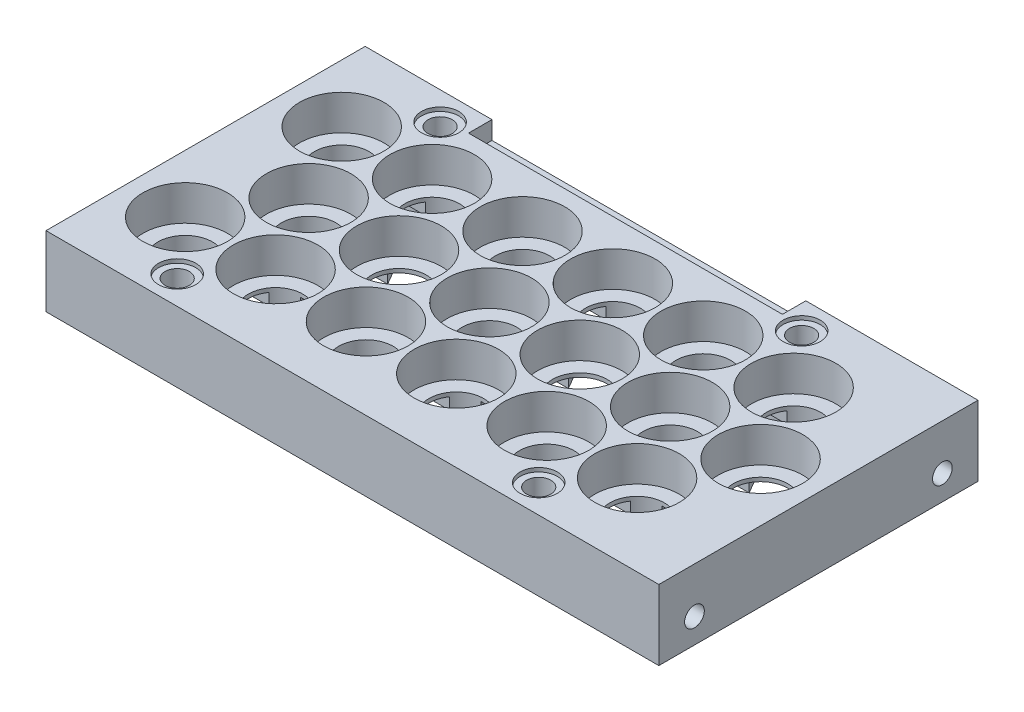
from build123d import *

# Parameters (mm, degrees)
BOSS_EXTRUDE2_DEPTH      = 11
BOSS_EXTRUDE2_DEPTH_BACK = 2
SKETCH1_W                = 156.975
SKETCH1_H                = 81.746976195
SKETCH1_R                = 10.825
BOSS_EXTRUDE3_DEPTH      = 2
BOSS_EXTRUDE3_DEPTH_BACK = 2
SKETCH1_3_R              = 10.825
SKETCH1_3_R_2            = 7
CUT_EXTRUDE1_DEPTH       = 3
CUT_EXTRUDE3_REACH       = 157.2
SKETCH9_R                = 3.1
SKETCH10_R               = 4.7625
CUT_EXTRUDE4_DEPTH       = 1
SKETCH13_W               = 156.975
SKETCH13_H               = 81.746976195
SKETCH13_R               = 3.1
BOSS_EXTRUDE7_DEPTH      = 5
SKETCH18_W               = 80.4
SKETCH18_H               = 4.825
CUT_EXTRUDE6_DEPTH       = 6
SKETCH19_R               = 2.525
CUT_EXTRUDE7_DEPTH       = 5
SKETCH20_R               = 2.525
CUT_EXTRUDE8_DEPTH       = 10
SKETCH21_R               = 1.9431
CUT_EXTRUDE9_DEPTH       = 3.81


with BuildPart() as part:
    # Sketch1 → Boss-Extrude2 (new, two sides: drawn at the far end of the back side and taken through both)
    with BuildSketch(Plane(origin=(0, 0, 0), x_dir=(1, 0, 0), z_dir=(0, 1, 0)).offset(-BOSS_EXTRUDE2_DEPTH_BACK)):
        with Locations((63.6625, -20.048488098)):
            Rectangle(SKETCH1_W, SKETCH1_H)
        with Locations(Location((115.75, -40.096976195, 0), (0, 0, 270))):
            Circle(SKETCH1_R, mode=Mode.SUBTRACT)
        with Locations(Location((127.325, -20.048488098, 0), (0, 0, 270))):
            Circle(SKETCH1_R, mode=Mode.SUBTRACT)
        with Locations(Location((115.75, 0, 0), (0, 0, 270))):
            Circle(SKETCH1_R, mode=Mode.SUBTRACT)
        with Locations(Location((92.6, -40.096976195, 0), (0, 0, 270))):
            Circle(SKETCH1_R, mode=Mode.SUBTRACT)
        with Locations(Location((104.175, -20.048488098, 0), (0, 0, 270))):
            Circle(SKETCH1_R, mode=Mode.SUBTRACT)
        with Locations(Location((92.6, 0, 0), (0, 0, 270))):
            Circle(SKETCH1_R, mode=Mode.SUBTRACT)
        with Locations(Location((69.45, -40.096976195, 0), (0, 0, 270))):
            Circle(SKETCH1_R, mode=Mode.SUBTRACT)
        with Locations(Location((81.025, -20.048488098, 0), (0, 0, 270))):
            Circle(SKETCH1_R, mode=Mode.SUBTRACT)
        with Locations(Location((69.45, 0, 0), (0, 0, 270))):
            Circle(SKETCH1_R, mode=Mode.SUBTRACT)
        with Locations(Location((46.3, -40.096976195, 0), (0, 0, 270))):
            Circle(SKETCH1_R, mode=Mode.SUBTRACT)
        with Locations(Location((57.875, -20.048488098, 0), (0, 0, 270))):
            Circle(SKETCH1_R, mode=Mode.SUBTRACT)
        with Locations(Location((46.3, 0, 0), (0, 0, 270))):
            Circle(SKETCH1_R, mode=Mode.SUBTRACT)
        with Locations(Location((23.15, -40.096976195, 0), (0, 0, 270))):
            Circle(SKETCH1_R, mode=Mode.SUBTRACT)
        with Locations(Location((34.725, -20.048488098, 0), (0, 0, 270))):
            Circle(SKETCH1_R, mode=Mode.SUBTRACT)
        with Locations(Location((23.15, 0, 0), (0, 0, 270))):
            Circle(SKETCH1_R, mode=Mode.SUBTRACT)
        with Locations(Location((0, -40.096976195, 0), (0, 0, 270))):
            Circle(SKETCH1_R, mode=Mode.SUBTRACT)
        with Locations(Location((11.575, -20.048488098, 0), (0, 0, 270))):
            Circle(SKETCH1_R, mode=Mode.SUBTRACT)
        with Locations(Location((0, 0, 0), (0, 0, 270))):
            Circle(SKETCH1_R, mode=Mode.SUBTRACT)
    extrude(amount=BOSS_EXTRUDE2_DEPTH + BOSS_EXTRUDE2_DEPTH_BACK)

    # Sketch1<3> → Boss-Extrude3 (add, two sides: drawn at the far end of the back side and taken through both)
    # profile 1 of 18: a face of its own
    with BuildSketch(Plane(origin=(0, 0, 0), x_dir=(1, 0, 0), z_dir=(0, 1, 0)).offset(-BOSS_EXTRUDE3_DEPTH_BACK)):
        with Locations(Location((0, 0, 0), (0, 0, 270))):
            Circle(SKETCH1_3_R)
        with Locations(Location((0, 0, 0), (0, 0, 270))):
            Circle(SKETCH1_3_R_2, mode=Mode.SUBTRACT)
    # profile 2 of 18: a face of its own
    with BuildSketch(Plane(origin=(0, 0, 0), x_dir=(1, 0, 0), z_dir=(0, 1, 0)).offset(-BOSS_EXTRUDE3_DEPTH_BACK)):
        with Locations(Location((23.15, 0, 0), (0, 0, 270))):
            Circle(SKETCH1_3_R)
        with Locations(Location((23.15, 0, 0), (0, 0, 270))):
            Circle(SKETCH1_3_R_2, mode=Mode.SUBTRACT)
    # profile 3 of 18: a face of its own
    with BuildSketch(Plane(origin=(0, 0, 0), x_dir=(1, 0, 0), z_dir=(0, 1, 0)).offset(-BOSS_EXTRUDE3_DEPTH_BACK)):
        with Locations(Location((46.3, 0, 0), (0, 0, 270))):
            Circle(SKETCH1_3_R)
        with Locations(Location((46.3, 0, 0), (0, 0, 270))):
            Circle(SKETCH1_3_R_2, mode=Mode.SUBTRACT)
    # profile 4 of 18: a face of its own
    with BuildSketch(Plane(origin=(0, 0, 0), x_dir=(1, 0, 0), z_dir=(0, 1, 0)).offset(-BOSS_EXTRUDE3_DEPTH_BACK)):
        with Locations(Location((69.45, 0, 0), (0, 0, 270))):
            Circle(SKETCH1_3_R)
        with Locations(Location((69.45, 0, 0), (0, 0, 270))):
            Circle(SKETCH1_3_R_2, mode=Mode.SUBTRACT)
    # profile 5 of 18: a face of its own
    with BuildSketch(Plane(origin=(0, 0, 0), x_dir=(1, 0, 0), z_dir=(0, 1, 0)).offset(-BOSS_EXTRUDE3_DEPTH_BACK)):
        with Locations(Location((92.6, 0, 0), (0, 0, 270))):
            Circle(SKETCH1_3_R)
        with Locations(Location((92.6, 0, 0), (0, 0, 270))):
            Circle(SKETCH1_3_R_2, mode=Mode.SUBTRACT)
    # profile 6 of 18: a face of its own
    with BuildSketch(Plane(origin=(0, 0, 0), x_dir=(1, 0, 0), z_dir=(0, 1, 0)).offset(-BOSS_EXTRUDE3_DEPTH_BACK)):
        with Locations(Location((115.75, 0, 0), (0, 0, 270))):
            Circle(SKETCH1_3_R)
        with Locations(Location((115.75, 0, 0), (0, 0, 270))):
            Circle(SKETCH1_3_R_2, mode=Mode.SUBTRACT)
    # profile 7 of 18: a face of its own
    with BuildSketch(Plane(origin=(0, 0, 0), x_dir=(1, 0, 0), z_dir=(0, 1, 0)).offset(-BOSS_EXTRUDE3_DEPTH_BACK)):
        with Locations(Location((11.575, -20.048488098, 0), (0, 0, 270))):
            Circle(SKETCH1_3_R)
        with Locations(Location((11.575, -20.048488098, 0), (0, 0, 270))):
            Circle(SKETCH1_3_R_2, mode=Mode.SUBTRACT)
    # profile 8 of 18: a face of its own
    with BuildSketch(Plane(origin=(0, 0, 0), x_dir=(1, 0, 0), z_dir=(0, 1, 0)).offset(-BOSS_EXTRUDE3_DEPTH_BACK)):
        with Locations(Location((34.725, -20.048488098, 0), (0, 0, 270))):
            Circle(SKETCH1_3_R)
        with Locations(Location((34.725, -20.048488098, 0), (0, 0, 270))):
            Circle(SKETCH1_3_R_2, mode=Mode.SUBTRACT)
    # profile 9 of 18: a face of its own
    with BuildSketch(Plane(origin=(0, 0, 0), x_dir=(1, 0, 0), z_dir=(0, 1, 0)).offset(-BOSS_EXTRUDE3_DEPTH_BACK)):
        with Locations(Location((57.875, -20.048488098, 0), (0, 0, 270))):
            Circle(SKETCH1_3_R)
        with Locations(Location((57.875, -20.048488098, 0), (0, 0, 270))):
            Circle(SKETCH1_3_R_2, mode=Mode.SUBTRACT)
    # profile 10 of 18: a face of its own
    with BuildSketch(Plane(origin=(0, 0, 0), x_dir=(1, 0, 0), z_dir=(0, 1, 0)).offset(-BOSS_EXTRUDE3_DEPTH_BACK)):
        with Locations(Location((81.025, -20.048488098, 0), (0, 0, 270))):
            Circle(SKETCH1_3_R)
        with Locations(Location((81.025, -20.048488098, 0), (0, 0, 270))):
            Circle(SKETCH1_3_R_2, mode=Mode.SUBTRACT)
    # profile 11 of 18: a face of its own
    with BuildSketch(Plane(origin=(0, 0, 0), x_dir=(1, 0, 0), z_dir=(0, 1, 0)).offset(-BOSS_EXTRUDE3_DEPTH_BACK)):
        with Locations(Location((104.175, -20.048488098, 0), (0, 0, 270))):
            Circle(SKETCH1_3_R)
        with Locations(Location((104.175, -20.048488098, 0), (0, 0, 270))):
            Circle(SKETCH1_3_R_2, mode=Mode.SUBTRACT)
    # profile 12 of 18: a face of its own
    with BuildSketch(Plane(origin=(0, 0, 0), x_dir=(1, 0, 0), z_dir=(0, 1, 0)).offset(-BOSS_EXTRUDE3_DEPTH_BACK)):
        with Locations(Location((127.325, -20.048488098, 0), (0, 0, 270))):
            Circle(SKETCH1_3_R)
        with Locations(Location((127.325, -20.048488098, 0), (0, 0, 270))):
            Circle(SKETCH1_3_R_2, mode=Mode.SUBTRACT)
    # profile 13 of 18: a face of its own
    with BuildSketch(Plane(origin=(0, 0, 0), x_dir=(1, 0, 0), z_dir=(0, 1, 0)).offset(-BOSS_EXTRUDE3_DEPTH_BACK)):
        with Locations(Location((115.75, -40.096976195, 0), (0, 0, 270))):
            Circle(SKETCH1_3_R)
        with Locations(Location((115.75, -40.096976195, 0), (0, 0, 270))):
            Circle(SKETCH1_3_R_2, mode=Mode.SUBTRACT)
    # profile 14 of 18: a face of its own
    with BuildSketch(Plane(origin=(0, 0, 0), x_dir=(1, 0, 0), z_dir=(0, 1, 0)).offset(-BOSS_EXTRUDE3_DEPTH_BACK)):
        with Locations(Location((92.6, -40.096976195, 0), (0, 0, 270))):
            Circle(SKETCH1_3_R)
        with Locations(Location((92.6, -40.096976195, 0), (0, 0, 270))):
            Circle(SKETCH1_3_R_2, mode=Mode.SUBTRACT)
    # profile 15 of 18: a face of its own
    with BuildSketch(Plane(origin=(0, 0, 0), x_dir=(1, 0, 0), z_dir=(0, 1, 0)).offset(-BOSS_EXTRUDE3_DEPTH_BACK)):
        with Locations(Location((69.45, -40.096976195, 0), (0, 0, 270))):
            Circle(SKETCH1_3_R)
        with Locations(Location((69.45, -40.096976195, 0), (0, 0, 270))):
            Circle(SKETCH1_3_R_2, mode=Mode.SUBTRACT)
    # profile 16 of 18: a face of its own
    with BuildSketch(Plane(origin=(0, 0, 0), x_dir=(1, 0, 0), z_dir=(0, 1, 0)).offset(-BOSS_EXTRUDE3_DEPTH_BACK)):
        with Locations(Location((46.3, -40.096976195, 0), (0, 0, 270))):
            Circle(SKETCH1_3_R)
        with Locations(Location((46.3, -40.096976195, 0), (0, 0, 270))):
            Circle(SKETCH1_3_R_2, mode=Mode.SUBTRACT)
    # profile 17 of 18: a face of its own
    with BuildSketch(Plane(origin=(0, 0, 0), x_dir=(1, 0, 0), z_dir=(0, 1, 0)).offset(-BOSS_EXTRUDE3_DEPTH_BACK)):
        with Locations(Location((23.15, -40.096976195, 0), (0, 0, 270))):
            Circle(SKETCH1_3_R)
        with Locations(Location((23.15, -40.096976195, 0), (0, 0, 270))):
            Circle(SKETCH1_3_R_2, mode=Mode.SUBTRACT)
    # profile 18 of 18: a face of its own
    with BuildSketch(Plane(origin=(0, 0, 0), x_dir=(1, 0, 0), z_dir=(0, 1, 0)).offset(-BOSS_EXTRUDE3_DEPTH_BACK)):
        with Locations(Location((0, -40.096976195, 0), (0, 0, 270))):
            Circle(SKETCH1_3_R)
        with Locations(Location((0, -40.096976195, 0), (0, 0, 270))):
            Circle(SKETCH1_3_R_2, mode=Mode.SUBTRACT)
    extrude(amount=BOSS_EXTRUDE3_DEPTH + BOSS_EXTRUDE3_DEPTH_BACK)

    # Sketch2 → Cut-Extrude1 (cut)
    with BuildSketch(Plane.XZ.offset(2)):
        with BuildLine():
            ThreePointArc((7, 40.096976195), (6.832081695, 38.57294873), (6.336382938, 37.12203901))
            Line((6.336382938, 37.12203901), (6.92820323, 36.096976195))
            Line((6.92820323, 36.096976195), (17.405437353, 36.096976195))
            ThreePointArc((17.405437353, 36.096976195), (16.15, 40.096976195), (17.405437353, 44.096976195))
            Line((17.405437353, 44.096976195), (5.744562647, 44.096976195))
            ThreePointArc((5.744562647, 44.096976195), (6.678770041, 42.193170541), (7, 40.096976195))
        make_face()
        with BuildLine():
            ThreePointArc((28.894562647, 36.096976195), (26.124937186, 33.760593257), (22.558179708, 33.12203901))
            Line((22.558179708, 33.12203901), (27.79679677, 24.048488098))
            Line((27.79679677, 24.048488098), (28.980437353, 24.048488098))
            ThreePointArc((28.980437353, 24.048488098), (31.750062814, 26.384871036), (35.316820292, 27.023425283))
            Line((35.316820292, 27.023425283), (30.07820323, 36.096976195))
            Line((30.07820323, 36.096976195), (28.894562647, 36.096976195))
        make_face()
        with BuildLine():
            Line((27.79679677, 24.048488098), (17.319562647, 24.048488098))
            ThreePointArc((17.319562647, 24.048488098), (18.253770041, 22.144682444), (18.575, 20.048488098))
            ThreePointArc((18.575, 20.048488098), (18.253770041, 17.952293751), (17.319562647, 16.048488098))
            Line((17.319562647, 16.048488098), (27.79679677, 16.048488098))
            Line((27.79679677, 16.048488098), (28.388617062, 17.073550912))
            ThreePointArc((28.388617062, 17.073550912), (27.725, 20.048488098), (28.388617062, 23.023425283))
            Line((28.388617062, 23.023425283), (27.79679677, 24.048488098))
        make_face()
        with BuildLine():
            ThreePointArc((7, 0), (6.678770041, -2.096194346), (5.744562647, -4))
            Line((5.744562647, -4), (17.405437353, -4))
            ThreePointArc((17.405437353, -4), (16.15, 0), (17.405437353, 4))
            Line((17.405437353, 4), (6.92820323, 4))
            Line((6.92820323, 4), (6.336382938, 2.974937186))
            ThreePointArc((6.336382938, 2.974937186), (6.832081695, 1.524027465), (7, 0))
        make_face()
        with BuildLine():
            Line((28.980437353, 16.048488098), (27.79679677, 16.048488098))
            Line((27.79679677, 16.048488098), (22.558179708, 6.974937186))
            ThreePointArc((22.558179708, 6.974937186), (26.124937186, 6.336382938), (28.894562647, 4))
            Line((28.894562647, 4), (30.07820323, 4))
            Line((30.07820323, 4), (35.316820292, 13.073550912))
            ThreePointArc((35.316820292, 13.073550912), (31.750062814, 13.712105159), (28.980437353, 16.048488098))
        make_face()
        with BuildLine():
            ThreePointArc((28.980437353, 16.048488098), (28.662822174, 16.548488098), (28.388617062, 17.073550912))
            Line((28.388617062, 17.073550912), (27.79679677, 16.048488098))
            Line((27.79679677, 16.048488098), (28.980437353, 16.048488098))
        make_face()
        with BuildLine():
            Line((28.980437353, 24.048488098), (27.79679677, 24.048488098))
            Line((27.79679677, 24.048488098), (28.388617062, 23.023425283))
            ThreePointArc((28.388617062, 23.023425283), (28.662822174, 23.548488098), (28.980437353, 24.048488098))
        make_face()
        with BuildLine():
            Line((6.92820323, 36.096976195), (6.336382938, 37.12203901))
            ThreePointArc((6.336382938, 37.12203901), (6.062177826, 36.596976195), (5.744562647, 36.096976195))
            Line((5.744562647, 36.096976195), (6.92820323, 36.096976195))
        make_face()
        with BuildLine():
            Line((6.92820323, 4), (5.744562647, 4))
            ThreePointArc((5.744562647, 4), (6.062177826, 3.5), (6.336382938, 2.974937186))
            Line((6.336382938, 2.974937186), (6.92820323, 4))
        make_face()
        with BuildLine():
            Line((30.07820323, 4), (28.894562647, 4))
            ThreePointArc((28.894562647, 4), (29.212177826, 3.5), (29.486382938, 2.974937186))
            Line((29.486382938, 2.974937186), (30.07820323, 4))
        make_face()
        with BuildLine():
            Line((74.688617062, 23.023425283), (74.09679677, 24.048488098))
            Line((74.09679677, 24.048488098), (63.619562647, 24.048488098))
            ThreePointArc((63.619562647, 24.048488098), (64.553770041, 22.144682444), (64.875, 20.048488098))
            ThreePointArc((64.875, 20.048488098), (64.553770041, 17.952293751), (63.619562647, 16.048488098))
            Line((63.619562647, 16.048488098), (74.09679677, 16.048488098))
            Line((74.09679677, 16.048488098), (74.688617062, 17.073550912))
            ThreePointArc((74.688617062, 17.073550912), (74.025, 20.048488098), (74.688617062, 23.023425283))
        make_face()
        with BuildLine():
            ThreePointArc((53.3, 0), (52.978770041, -2.096194346), (52.044562647, -4))
            Line((52.044562647, -4), (63.705437353, -4))
            ThreePointArc((63.705437353, -4), (62.45, 0), (63.705437353, 4))
            Line((63.705437353, 4), (53.22820323, 4))
            Line((53.22820323, 4), (52.636382938, 2.974937186))
            ThreePointArc((52.636382938, 2.974937186), (53.132081695, 1.524027465), (53.3, 0))
        make_face()
        with BuildLine():
            Line((63.705437353, 44.096976195), (52.044562647, 44.096976195))
            ThreePointArc((52.044562647, 44.096976195), (52.978770041, 42.193170541), (53.3, 40.096976195))
            ThreePointArc((53.3, 40.096976195), (53.132081695, 38.57294873), (52.636382938, 37.12203901))
            Line((52.636382938, 37.12203901), (53.22820323, 36.096976195))
            Line((53.22820323, 36.096976195), (63.705437353, 36.096976195))
            ThreePointArc((63.705437353, 36.096976195), (62.45, 40.096976195), (63.705437353, 44.096976195))
        make_face()
        with BuildLine():
            ThreePointArc((75.194562647, 36.096976195), (72.424937186, 33.760593257), (68.858179708, 33.12203901))
            Line((68.858179708, 33.12203901), (74.09679677, 24.048488098))
            Line((74.09679677, 24.048488098), (75.280437353, 24.048488098))
            ThreePointArc((75.280437353, 24.048488098), (78.050062814, 26.384871036), (81.616820292, 27.023425283))
            Line((81.616820292, 27.023425283), (76.37820323, 36.096976195))
            Line((76.37820323, 36.096976195), (75.194562647, 36.096976195))
        make_face()
        with BuildLine():
            Line((75.280437353, 16.048488098), (74.09679677, 16.048488098))
            Line((74.09679677, 16.048488098), (68.858179708, 6.974937186))
            ThreePointArc((68.858179708, 6.974937186), (72.424937186, 6.336382938), (75.194562647, 4))
            Line((75.194562647, 4), (76.37820323, 4))
            Line((76.37820323, 4), (81.616820292, 13.073550912))
            ThreePointArc((81.616820292, 13.073550912), (78.050062814, 13.712105159), (75.280437353, 16.048488098))
        make_face()
        with BuildLine():
            ThreePointArc((99.6, 0), (99.278770041, -2.096194346), (98.344562647, -4))
            Line((98.344562647, -4), (110.005437353, -4))
            ThreePointArc((110.005437353, -4), (108.75, 0), (110.005437353, 4))
            Line((110.005437353, 4), (99.52820323, 4))
            Line((99.52820323, 4), (98.936382938, 2.974937186))
            ThreePointArc((98.936382938, 2.974937186), (99.432081695, 1.524027465), (99.6, 0))
        make_face()
        with BuildLine():
            Line((120.988617062, 23.023425283), (120.39679677, 24.048488098))
            Line((120.39679677, 24.048488098), (109.919562647, 24.048488098))
            ThreePointArc((109.919562647, 24.048488098), (110.853770041, 22.144682444), (111.175, 20.048488098))
            ThreePointArc((111.175, 20.048488098), (110.853770041, 17.952293751), (109.919562647, 16.048488098))
            Line((109.919562647, 16.048488098), (120.39679677, 16.048488098))
            Line((120.39679677, 16.048488098), (120.988617062, 17.073550912))
            ThreePointArc((120.988617062, 17.073550912), (120.325, 20.048488098), (120.988617062, 23.023425283))
        make_face()
        with BuildLine():
            Line((110.005437353, 44.096976195), (98.344562647, 44.096976195))
            ThreePointArc((98.344562647, 44.096976195), (99.278770041, 42.193170541), (99.6, 40.096976195))
            ThreePointArc((99.6, 40.096976195), (99.432081695, 38.57294873), (98.936382938, 37.12203901))
            Line((98.936382938, 37.12203901), (99.52820323, 36.096976195))
            Line((99.52820323, 36.096976195), (110.005437353, 36.096976195))
            ThreePointArc((110.005437353, 36.096976195), (108.75, 40.096976195), (110.005437353, 44.096976195))
        make_face()
        with BuildLine():
            Line((127.916820292, 27.023425283), (122.086382938, 37.12203901))
            ThreePointArc((122.086382938, 37.12203901), (119.25, 34.034798369), (115.158179708, 33.12203901))
            Line((115.158179708, 33.12203901), (120.39679677, 24.048488098))
            Line((120.39679677, 24.048488098), (121.580437353, 24.048488098))
            ThreePointArc((121.580437353, 24.048488098), (124.350062814, 26.384871036), (127.916820292, 27.023425283))
        make_face()
        with BuildLine():
            Line((122.086382938, 2.974937186), (127.916820292, 13.073550912))
            ThreePointArc((127.916820292, 13.073550912), (124.350062814, 13.712105159), (121.580437353, 16.048488098))
            Line((121.580437353, 16.048488098), (120.39679677, 16.048488098))
            Line((120.39679677, 16.048488098), (115.158179708, 6.974937186))
            ThreePointArc((115.158179708, 6.974937186), (119.25, 6.062177826), (122.086382938, 2.974937186))
        make_face()
        with BuildLine():
            ThreePointArc((121.580437353, 16.048488098), (121.262822174, 16.548488098), (120.988617062, 17.073550912))
            Line((120.988617062, 17.073550912), (120.39679677, 16.048488098))
            Line((120.39679677, 16.048488098), (121.580437353, 16.048488098))
        make_face()
        with BuildLine():
            Line((121.580437353, 24.048488098), (120.39679677, 24.048488098))
            Line((120.39679677, 24.048488098), (120.988617062, 23.023425283))
            ThreePointArc((120.988617062, 23.023425283), (121.262822174, 23.548488098), (121.580437353, 24.048488098))
        make_face()
        with BuildLine():
            ThreePointArc((98.344562647, 4), (98.662177826, 3.5), (98.936382938, 2.974937186))
            Line((98.936382938, 2.974937186), (99.52820323, 4))
            Line((99.52820323, 4), (98.344562647, 4))
        make_face()
        with BuildLine():
            Line((99.52820323, 36.096976195), (98.936382938, 37.12203901))
            ThreePointArc((98.936382938, 37.12203901), (98.662177826, 36.596976195), (98.344562647, 36.096976195))
            Line((98.344562647, 36.096976195), (99.52820323, 36.096976195))
        make_face()
        with BuildLine():
            ThreePointArc((75.194562647, 4), (75.512177826, 3.5), (75.786382938, 2.974937186))
            Line((75.786382938, 2.974937186), (76.37820323, 4))
            Line((76.37820323, 4), (75.194562647, 4))
        make_face()
        with BuildLine():
            Line((76.37820323, 36.096976195), (75.786382938, 37.12203901))
            ThreePointArc((75.786382938, 37.12203901), (75.512177826, 36.596976195), (75.194562647, 36.096976195))
            Line((75.194562647, 36.096976195), (76.37820323, 36.096976195))
        make_face()
        with BuildLine():
            Line((53.22820323, 4), (52.044562647, 4))
            ThreePointArc((52.044562647, 4), (52.362177826, 3.5), (52.636382938, 2.974937186))
            Line((52.636382938, 2.974937186), (53.22820323, 4))
        make_face()
        with BuildLine():
            ThreePointArc((75.280437353, 16.048488098), (74.962822174, 16.548488098), (74.688617062, 17.073550912))
            Line((74.688617062, 17.073550912), (74.09679677, 16.048488098))
            Line((74.09679677, 16.048488098), (75.280437353, 16.048488098))
        make_face()
        with BuildLine():
            Line((75.280437353, 24.048488098), (74.09679677, 24.048488098))
            Line((74.09679677, 24.048488098), (74.688617062, 23.023425283))
            ThreePointArc((74.688617062, 23.023425283), (74.962822174, 23.548488098), (75.280437353, 24.048488098))
        make_face()
        with BuildLine():
            Line((53.22820323, 36.096976195), (52.636382938, 37.12203901))
            ThreePointArc((52.636382938, 37.12203901), (52.362177826, 36.596976195), (52.044562647, 36.096976195))
            Line((52.044562647, 36.096976195), (53.22820323, 36.096976195))
        make_face()
        with BuildLine():
            ThreePointArc((29.486382938, 37.12203901), (29.212177826, 36.596976195), (28.894562647, 36.096976195))
            Line((28.894562647, 36.096976195), (30.07820323, 36.096976195))
            Line((30.07820323, 36.096976195), (29.486382938, 37.12203901))
        make_face()
    extrude(amount=-CUT_EXTRUDE1_DEPTH, mode=Mode.SUBTRACT)

    # Sketch9 → Cut-Extrude3 (cut, up to next)
    with BuildSketch(Plane(origin=(0, 11, 0), x_dir=(1, 0, 0), z_dir=(0, 1, 0)), mode=Mode.PRIVATE) as cut_extrude3_sk1:
        with Locations(Location((11.575, 13.625, 0), (0, 0, 270))):
            Circle(SKETCH9_R)
    cut_extrude3_tool1 = extrude(cut_extrude3_sk1.sketch, amount=-CUT_EXTRUDE3_REACH, mode=Mode.PRIVATE) & part.part
    # Sketch9 → Cut-Extrude3 (cut, up to next)
    with BuildSketch(Plane(origin=(0, 11, 0), x_dir=(1, 0, 0), z_dir=(0, 1, 0)), mode=Mode.PRIVATE) as cut_extrude3_sk2:
        with Locations(Location((11.575, -53.721976195, 0), (0, 0, 270))):
            Circle(SKETCH9_R)
    cut_extrude3_tool2 = extrude(cut_extrude3_sk2.sketch, amount=-CUT_EXTRUDE3_REACH, mode=Mode.PRIVATE) & part.part
    # Sketch9 → Cut-Extrude3 (cut, up to next)
    with BuildSketch(Plane(origin=(0, 11, 0), x_dir=(1, 0, 0), z_dir=(0, 1, 0)), mode=Mode.PRIVATE) as cut_extrude3_sk3:
        with Locations(Location((104.175, -53.721976195, 0), (0, 0, 270))):
            Circle(SKETCH9_R)
    cut_extrude3_tool3 = extrude(cut_extrude3_sk3.sketch, amount=-CUT_EXTRUDE3_REACH, mode=Mode.PRIVATE) & part.part
    # Sketch9 → Cut-Extrude3 (cut, up to next)
    with BuildSketch(Plane(origin=(0, 11, 0), x_dir=(1, 0, 0), z_dir=(0, 1, 0)), mode=Mode.PRIVATE) as cut_extrude3_sk4:
        with Locations(Location((104.175, 13.625, 0), (0, 0, 270))):
            Circle(SKETCH9_R)
    cut_extrude3_tool4 = extrude(cut_extrude3_sk4.sketch, amount=-CUT_EXTRUDE3_REACH, mode=Mode.PRIVATE) & part.part
    add(cut_extrude3_tool1.solids().sort_by_distance((11.575, 11, -13.625))[0], mode=Mode.SUBTRACT)
    add(cut_extrude3_tool2.solids().sort_by_distance((11.575, 11, 53.721976))[0], mode=Mode.SUBTRACT)
    add(cut_extrude3_tool3.solids().sort_by_distance((104.175, 11, 53.721976))[0], mode=Mode.SUBTRACT)
    add(cut_extrude3_tool4.solids().sort_by_distance((104.175, 11, -13.625))[0], mode=Mode.SUBTRACT)

    # Sketch10 → Cut-Extrude4 (cut)
    with BuildSketch(Plane(origin=(0, 11, 0), x_dir=(1, 0, 0), z_dir=(0, 1, 0))):
        with Locations(Location((11.575, 13.625, 0), (0, 0, 270))):
            Circle(SKETCH10_R)
        with Locations(Location((104.175, 13.625, 0), (0, 0, 270))):
            Circle(SKETCH10_R)
        with Locations(Location((104.175, -53.721976195, 0), (0, 0, 270))):
            Circle(SKETCH10_R)
        with Locations(Location((11.575, -53.721976195, 0), (0, 0, 270))):
            Circle(SKETCH10_R)
    extrude(amount=-CUT_EXTRUDE4_DEPTH, mode=Mode.SUBTRACT)

    # Sketch13 → Boss-Extrude7 (add)
    with BuildSketch(Plane.XZ.offset(2)):
        with Locations((63.6625, 20.048488098)):
            Rectangle(SKETCH13_W, SKETCH13_H)
        with BuildLine():
            ThreePointArc((3.577500391, 53.921976195), (11.575, 45.721976195), (19.572499609, 53.921976195))
            Line((19.572499609, 53.921976195), (96.177500391, 53.921976195))
            ThreePointArc((96.177500391, 53.921976195), (104.175, 45.721976195), (112.172499609, 53.921976195))
            Line((112.172499609, 53.921976195), (125.15, 53.921976195))
            Line((125.15, 53.921976195), (137.15, 41.921976195))
            Line((137.15, 41.921976195), (137.15, -1.825))
            Line((137.15, -1.825), (125.15, -13.825))
            Line((125.15, -13.825), (112.172499609, -13.825))
            ThreePointArc((112.172499609, -13.825), (104.175, -5.625), (96.177500391, -13.825))
            Line((96.177500391, -13.825), (19.572499609, -13.825))
            ThreePointArc((19.572499609, -13.825), (11.575, -5.625), (3.577500391, -13.825))
            Line((3.577500391, -13.825), (-9.825, -13.825))
            Line((-9.825, -13.825), (-9.825, 53.921976195))
            Line((-9.825, 53.921976195), (3.577500391, 53.921976195))
        make_face(mode=Mode.SUBTRACT)
        with Locations(Location((11.575, 53.721976195, 0), (0, 0, 90))):
            Circle(SKETCH13_R, mode=Mode.SUBTRACT)
        with Locations(Location((104.175, 53.721976195, 0), (0, 0, 90))):
            Circle(SKETCH13_R, mode=Mode.SUBTRACT)
        with Locations(Location((11.575, -13.625, 0), (0, 0, 90))):
            Circle(SKETCH13_R, mode=Mode.SUBTRACT)
        with Locations(Location((104.175, -13.625, 0), (0, 0, 90))):
            Circle(SKETCH13_R, mode=Mode.SUBTRACT)
    extrude(amount=BOSS_EXTRUDE7_DEPTH)

    # Sketch18 → Cut-Extrude6 (cut)
    with BuildSketch(Plane(origin=(0, 0, -20.825), x_dir=(-1, 0, 0), z_dir=(0, 0, -1))):
        with Locations((-57.85, 8.7875)):
            Rectangle(SKETCH18_W, SKETCH18_H)
    extrude(amount=-CUT_EXTRUDE6_DEPTH, mode=Mode.SUBTRACT)

    # Sketch19 → Cut-Extrude7 (cut)
    with BuildSketch(Plane(origin=(0, 0, -20.825), x_dir=(-1, 0, 0), z_dir=(0, 0, -1))):
        with Locations((-86.05, -0.3125)):
            Circle(SKETCH19_R)
        with Locations((-29.65, -0.3125)):
            Circle(SKETCH19_R)
    extrude(amount=-CUT_EXTRUDE7_DEPTH, mode=Mode.SUBTRACT)

    # Sketch20 → Cut-Extrude8 (cut)
    with BuildSketch(Plane(origin=(142.15, 0, 0), x_dir=(0, 0, -1), z_dir=(1, 0, 0))):
        with Locations((-51.798488098, -0.65)):
            Circle(SKETCH20_R)
        with Locations((11.701511902, -0.65)):
            Circle(SKETCH20_R)
    extrude(amount=-CUT_EXTRUDE8_DEPTH, mode=Mode.SUBTRACT)

    # Sketch21 → Cut-Extrude9 (cut)
    with BuildSketch(Plane.XZ.offset(2)):
        with Locations(Location((57.875, 49.009476195, 0), (0, 0, 270))):
            Circle(SKETCH21_R)
        with Locations(Location((129.828956015, 41.921976195, 0), (0, 0, 270))):
            Circle(SKETCH21_R)
        with Locations(Location((-2.625, 20.048488098, 0), (0, 0, 270))):
            Circle(SKETCH21_R)
        with Locations(Location((129.828956015, -1.825, 0), (0, 0, 90))):
            Circle(SKETCH21_R)
        with Locations(Location((57.875, -8.9125, 0), (0, 0, 90))):
            Circle(SKETCH21_R)
    extrude(amount=-CUT_EXTRUDE9_DEPTH, mode=Mode.SUBTRACT)


solid = part.part
